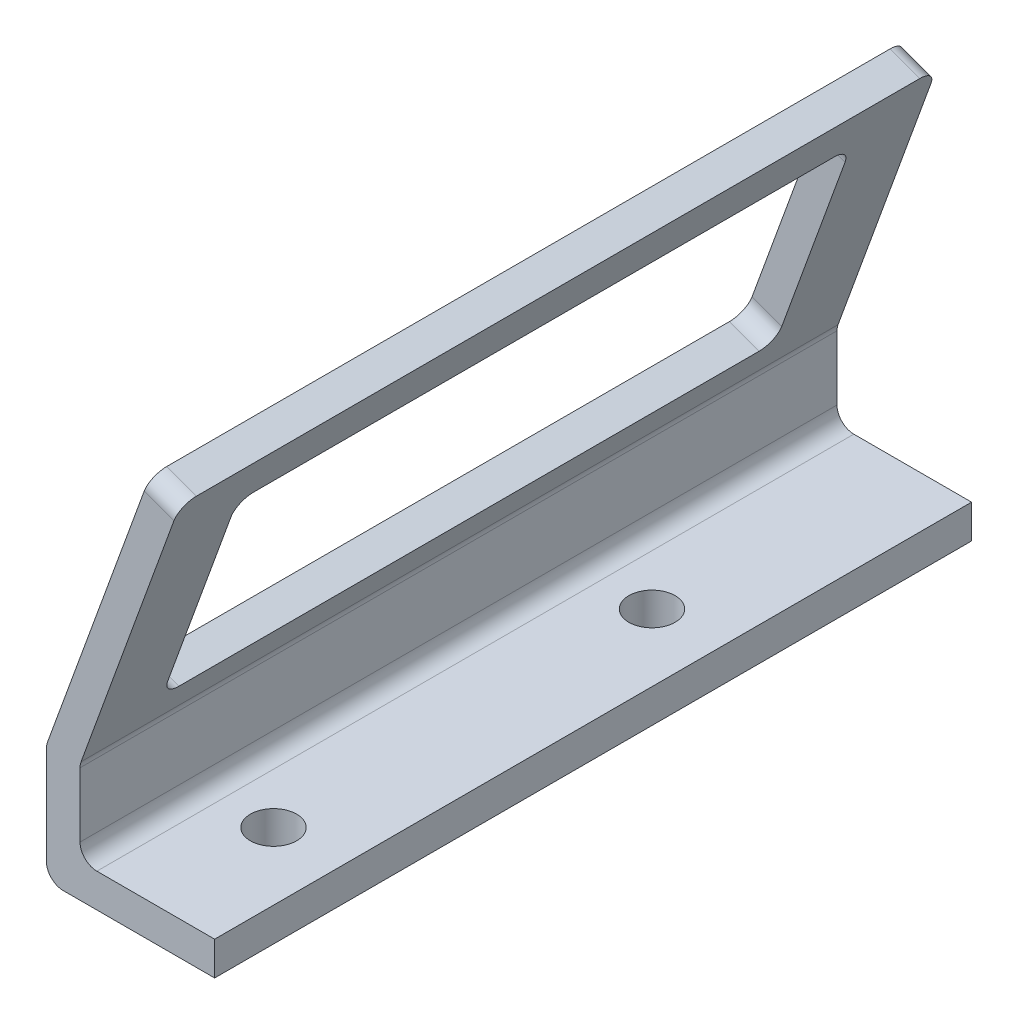
from build123d import *

# Parameters (mm, degrees)
SKETCH_1_W          = 4
SKETCH_1_H          = 10
SKETCH_1_W_2        = 20
SKETCH_1_H_2        = 4
EXTRUDE_1_DEPTH     = 45
SKETCH_2_W          = 73
SKETCH_2_H          = 26
CUT_EXTRUDE_1_DEPTH = 5
FILLET_1_R          = 2
SKETCH_3_R          = 2.75
CUT_EXTRUDE_2_DEPTH = 5


with BuildPart() as part:
    # 스케치1 → 보스-돌출1 (new, symmetric)
    with BuildSketch(Plane.XY):
        Polygon((5.844814046, 44.543359129), (-6, 12), (-10, 12), (2.31272516, 45.828934348), align=None)
        with Locations((-8, 7)):
            Rectangle(SKETCH_1_W, SKETCH_1_H)
        Rectangle(SKETCH_1_W_2, SKETCH_1_H_2)
    extrude(amount=EXTRUDE_1_DEPTH, both=True)

    # 스케치2 → 컷-돌출1 (cut)
    with BuildSketch(Plane(origin=(-12.686947874, 4.61767139, 0), x_dir=(0, 0, 1), z_dir=(-0.9396926207859106, 0.34202014332566244, 0))):
        with Locations((0, 25.856110016)):
            Rectangle(SKETCH_2_W, SKETCH_2_H)
    extrude(amount=-CUT_EXTRUDE_1_DEPTH, mode=Mode.SUBTRACT)

    # 필렛1
    fillet_1_edges = [part.edges().sort_by_distance(p)[0] for p in [
        (4.078769603, 45.186146739, 45),
        (4.078769603, 45.186146739, -45),
        (-6, 12, 0),
        (-6, 2, 0),
        (-10, -2, 0),
        (-10, 12, 0),
        (2.368668886, 40.487683635, 36.5),
        (-6.52385484, 16.055675494, 36.5),
        (-6.52385484, 16.055675494, -36.5),
        (2.368668886, 40.487683635, -36.5),
    ]]
    fillet(fillet_1_edges, radius=FILLET_1_R)

    # 스케치3 → 컷-돌출2 (cut)
    with BuildSketch(Plane(origin=(0, 2, 0), x_dir=(1, 0, 0), z_dir=(0, 1, 0))):
        with Locations(Location((2, -30, 0), (0, 0, 270))):
            Circle(SKETCH_3_R)
        with Locations(Location((2, 15, 0), (0, 0, 270))):
            Circle(SKETCH_3_R)
    extrude(amount=-CUT_EXTRUDE_2_DEPTH, mode=Mode.SUBTRACT)


solid = part.part
